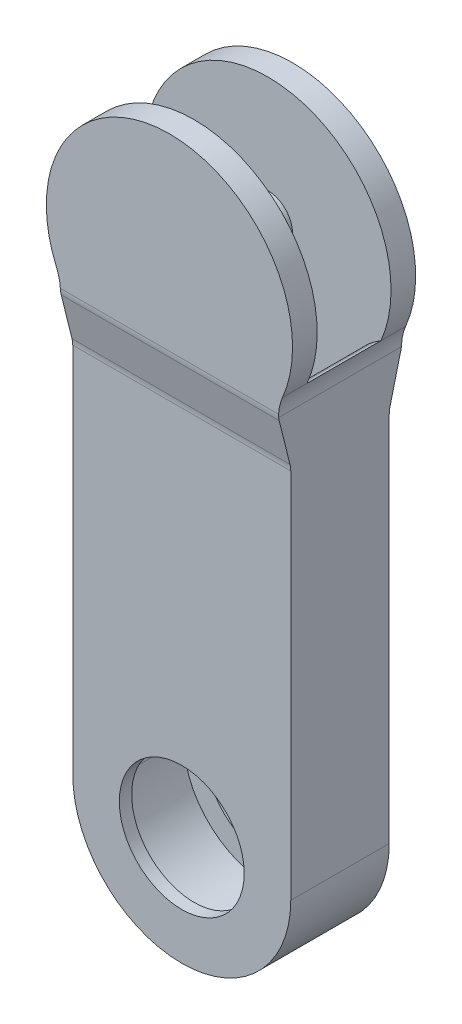
from build123d import *

# Parameters (mm, degrees)
BOSS_EXTRU_1_DEPTH      = 25
ENL_V_MAT_EXTRU_1_DEPTH = 15
ESQUISSE4_R             = 25.355
ENL_V_MAT_EXTRU_2_DEPTH = 255.301687519
ESQUISSE5_R             = 10
BOSS_EXTRU_2_DEPTH      = 30
ENL_V_MAT_EXTRU_3_DEPTH = 264.024268847
CONG_1_R                = 10


with BuildPart() as part:
    # Esquisse1 → Boss.-Extru.1 (new, symmetric)
    with BuildSketch(Plane.XY):
        with BuildLine():
            Line((44.273101825, -200), (44.273101825, -27.730279152))
            ThreePointArc((44.273101825, -27.730279152), (44.686437132, -23.685212253), (45.909358446, -19.807342251))
            ThreePointArc((45.909358446, -19.807342251), (0, 50), (-45.909358446, -19.807342251))
            ThreePointArc((-45.909358446, -19.807342251), (-44.686437132, -23.685212253), (-44.273101825, -27.730279152))
            Line((-44.273101825, -27.730279152), (-44.273101825, -200))
            ThreePointArc((-44.273101825, -200), (0, -244.273101825), (44.273101825, -200))
        make_face()
    extrude(amount=BOSS_EXTRU_1_DEPTH, both=True)

    # Esquisse3 → Enlèv. mat.-Extru.1 (cut, symmetric)
    with BuildSketch(Plane.XY):
        with BuildLine():
            Line((34.273101825, -200), (34.273101825, -38.308494588))
            ThreePointArc((34.273101825, -38.308494588), (36.593682253, -28.957659138), (43.016914187, -21.776760261))
            Line((43.016914187, -21.776760261), (45.909358446, -19.807342251))
            ThreePointArc((45.909358446, -19.807342251), (0, 50), (-45.909358446, -19.807342251))
            Line((-45.909358446, -19.807342251), (-43.016914187, -21.776760261))
            ThreePointArc((-43.016914187, -21.776760261), (-36.593682253, -28.957659138), (-34.273101825, -38.308494588))
            Line((-34.273101825, -38.308494588), (-34.273101825, -200))
            ThreePointArc((-34.273101825, -200), (0, -234.273101825), (34.273101825, -200))
        make_face()
    extrude(amount=ENL_V_MAT_EXTRU_1_DEPTH, both=True, mode=Mode.SUBTRACT)

    # Esquisse4 → Enlèv. mat.-Extru.2 (cut, through all)
    with BuildSketch(Plane.XY.offset(25)):
        with Locations((0, -200)):
            Circle(ESQUISSE4_R)
    extrude(amount=-ENL_V_MAT_EXTRU_2_DEPTH, mode=Mode.SUBTRACT)

    # Esquisse5 → Boss.-Extru.2 (add)
    with BuildSketch(Plane.XY.offset(-15)):
        with Locations(Location((0, 0, 0), (0, 0, 180))):
            Circle(ESQUISSE5_R)
    extrude(amount=BOSS_EXTRU_2_DEPTH)

    # Esquisse6 → Enlèv. mat.-Extru.3 (cut, through all)
    with BuildSketch(Plane.ZY.offset(44.273101825)):
        Polygon((-25, -27.730279152), (-20, -47.730279152), (-20, -248.850889137), (-25, -248.850889137), align=None)
        Polygon((20, -248.850889137), (25, -248.850889137), (25, -27.730279152), (20, -47.730279152), align=None)
    extrude(amount=-ENL_V_MAT_EXTRU_3_DEPTH, mode=Mode.SUBTRACT)

    # Congé1
    cong_1_edges = [part.edges().sort_by_distance(p)[0] for p in [
        (0, -27.730279152, -25),
        (0, -47.730279152, -20),
        (0, -47.730279152, 20),
        (0, -27.730279152, 25),
    ]]
    fillet(cong_1_edges, radius=CONG_1_R)


solid = part.part
